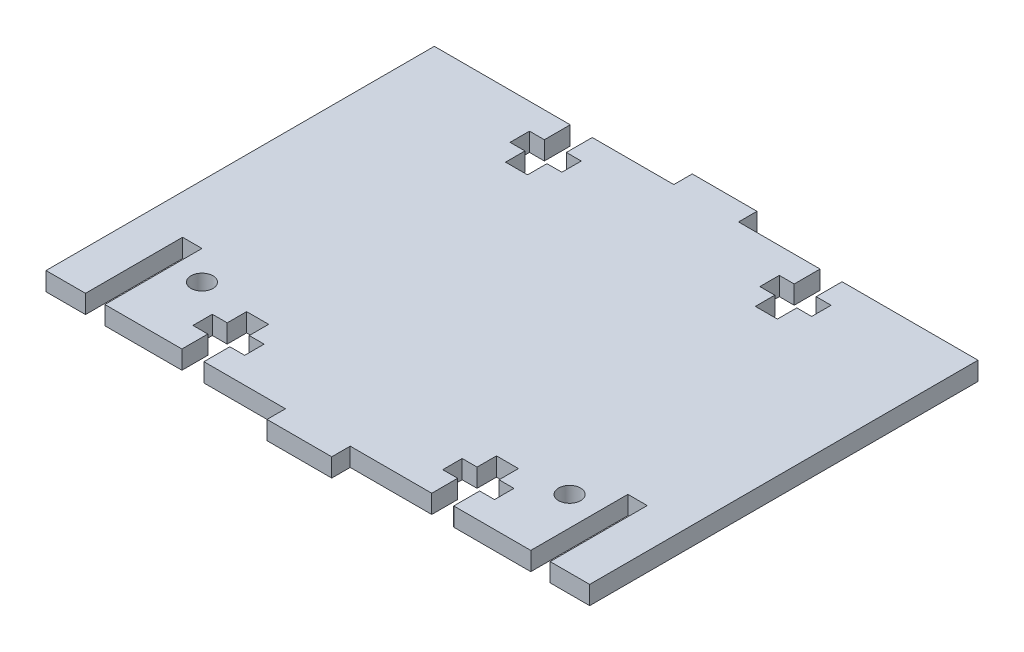
from build123d import *

# Parameters (mm, degrees)
SKETCH1_W            = 84
SKETCH1_H            = 60
BOSS_EXTRUDE1_DEPTH  = 2.85
SKETCH2_W            = 3
SKETCH2_H            = 15
CUT_EXTRUDE1_DEPTH   = 52.692576837
CUT_EXTRUDE2_DEPTH   = 52.692576837
SKETCH4_W            = 10
SKETCH4_H            = 2.85
BOSS_EXTRUDE2_DEPTH  = 2.85
MIRROR3_COPY_1_DEPTH = 52.692576837
SKETCH5_R            = 1.7
CUT_EXTRUDE3_DEPTH   = 6


with BuildPart() as part:
    # Sketch1 → Boss-Extrude1 (new body)
    with BuildSketch(Plane(origin=(0, 0, 0), x_dir=(1, 0, 0), z_dir=(0, 1, 0))):
        Rectangle(SKETCH1_W, SKETCH1_H)
    extrude(amount=BOSS_EXTRUDE1_DEPTH)

    # Sketch2 → Cut-Extrude1 (cut, through all)
    with BuildSketch(Plane.XZ):
        with Locations((-34.4, 22.5)):
            Rectangle(SKETCH2_W, SKETCH2_H)
    cut_extrude1 = extrude(amount=-CUT_EXTRUDE1_DEPTH, mode=Mode.SUBTRACT)

    # Mirror1: Cut-Extrude1 across plane
    add(cut_extrude1.mirror(Plane(origin=(0, 0, 0), x_dir=(0, 0, 1), z_dir=(1, 0, 0))), mode=Mode.SUBTRACT)

    # Sketch3 → Cut-Extrude2 (cut, through all)
    with BuildSketch(Plane(origin=(0, 2.85, 0), x_dir=(1, 0, 0), z_dir=(0, 1, 0))):
        Polygon((-23.3, 26), (-21, 26), (-21, 30), (-17.6, 30), (-17.6, 26), (-15.3, 26), (-15.3, 23), (-17.6, 23), (-17.6, 20), (-21, 20), (-21, 23), (-23.3, 23), align=None)
    cut_extrude2 = extrude(amount=-CUT_EXTRUDE2_DEPTH, mode=Mode.SUBTRACT)

    # Mirror2: Cut-Extrude2 across plane
    add(cut_extrude2.mirror(Plane(origin=(0, 0, 0), x_dir=(0, 0, 1), z_dir=(1, 0, 0))), mode=Mode.SUBTRACT)

    # Sketch4 → Boss-Extrude2 (add)
    with BuildSketch(Plane(origin=(0, 2.85, 0), x_dir=(1, 0, 0), z_dir=(0, 1, 0))):
        with Locations((0, 31.425)):
            Rectangle(SKETCH4_W, SKETCH4_H)
    boss_extrude2 = extrude(amount=-BOSS_EXTRUDE2_DEPTH)

    # Mirror3: Cut-Extrude2, Boss-Extrude2 across plane
    add(cut_extrude2.mirror(Plane.XY), mode=Mode.SUBTRACT)
    add(boss_extrude2.mirror(Plane.XY))

    # Mirror3 copy 1 sketch → Mirror3 copy 1 (cut, through all)
    with BuildSketch(Plane(origin=(0, 2.85, 0), x_dir=(-1, 0, 0), z_dir=(0, 1, 0))):
        Polygon((-23.3, 26), (-21, 26), (-21, 30), (-17.6, 30), (-17.6, 26), (-15.3, 26), (-15.3, 23), (-17.6, 23), (-17.6, 20), (-21, 20), (-21, 23), (-23.3, 23), align=None)
    extrude(amount=-MIRROR3_COPY_1_DEPTH, mode=Mode.SUBTRACT)

    # Sketch5 → Cut-Extrude3 (cut)
    with BuildSketch(Plane(origin=(0, 5.35, 32.85), x_dir=(1, 0, 0), z_dir=(0, 1, 0))):
        with Locations(Location((-28.4, 13.35, 0), (0, 0, 270))):
            Circle(SKETCH5_R)
    cut_extrude3 = extrude(amount=-CUT_EXTRUDE3_DEPTH, mode=Mode.SUBTRACT)

    # Mirror4: Cut-Extrude3 across plane
    add(cut_extrude3.mirror(Plane(origin=(0, 0, 0), x_dir=(0, 0, 1), z_dir=(1, 0, 0))), mode=Mode.SUBTRACT)


solid = part.part
